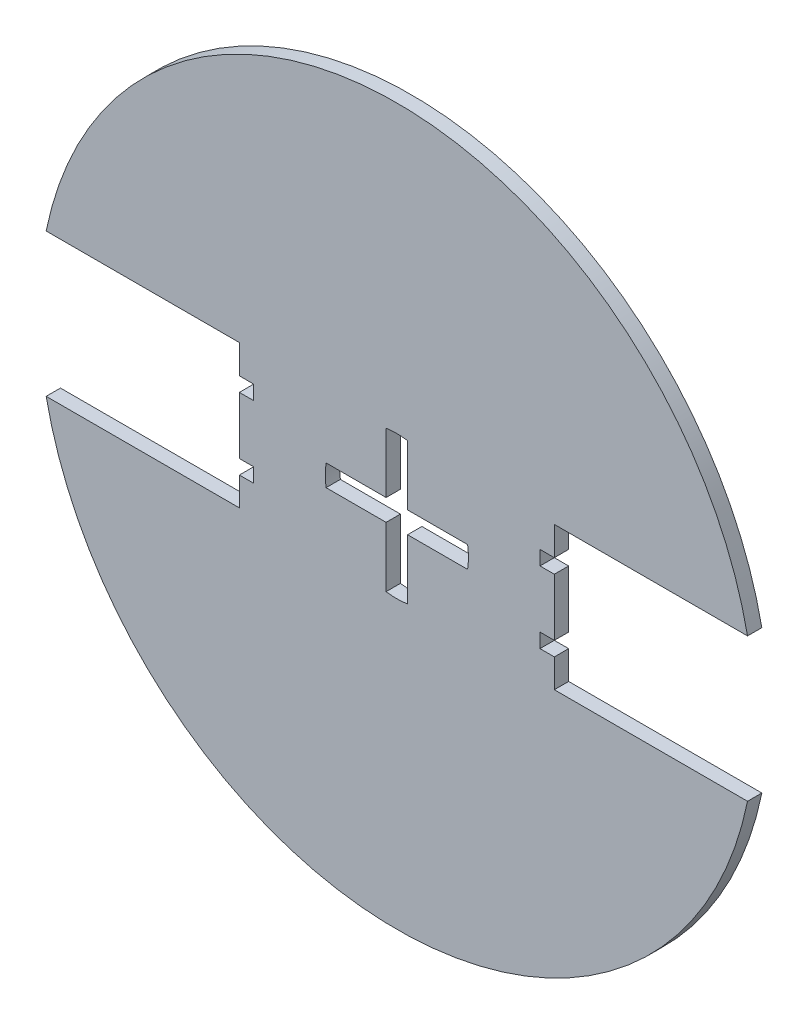
from build123d import *

# Parameters (mm, degrees)
BOSS_EXTRUDE5_DEPTH = 2
CUT_EXTRUDE17_DEPTH = 2
SKETCH11_3_W        = 3
SKETCH11_3_H        = 3
CUT_EXTRUDE18_DEPTH = 2
CUT_EXTRUDE19_DEPTH = 2
SKETCH14_W          = 2.001486185
SKETCH14_H          = 2
CUT_EXTRUDE20_DEPTH = 2
SKETCH13_W          = 2.001486185
SKETCH13_H          = 2
CUT_EXTRUDE21_DEPTH = 2


with BuildPart() as part:
    # Sketch1 → Boss-Extrude5 (new body)
    with BuildSketch(Plane.XY):
        with BuildLine():
            Line((-22, 10), (-22, -10))
            Line((-22, -10), (-48.989794856, -10))
            ThreePointArc((-48.989794856, -10), (50, 0), (-48.989794856, 10))
            Line((-48.989794856, 10), (-22, 10))
        make_face()
    extrude(amount=-BOSS_EXTRUDE5_DEPTH)

    # Sketch11 → Cut-Extrude17 (cut)
    with BuildSketch(Plane(origin=(0, 0, -2), x_dir=(-1, 0, 0), z_dir=(0, 0, -1))):
        with BuildLine():
            Line((-1.5, 1.5), (1.5, 1.5))
            Line((1.5, 1.5), (1.5, 9.886859967))
            ThreePointArc((1.5, 9.886859967), (0, 10), (-1.5, 9.886859967))
            Line((-1.5, 9.886859967), (-1.5, 1.5))
        make_face()
    extrude(amount=-CUT_EXTRUDE17_DEPTH, mode=Mode.SUBTRACT)

    # Sketch11<3> → Cut-Extrude18 (cut)
    with BuildSketch(Plane(origin=(0, 0, -2), x_dir=(-1, 0, 0), z_dir=(0, 0, -1))):
        with BuildLine():
            Line((-9.886859967, -1.5), (-1.5, -1.5))
            Line((-1.5, -1.5), (-1.5, 1.5))
            Line((-1.5, 1.5), (-9.886859967, 1.5))
            ThreePointArc((-9.886859967, 1.5), (-10, 0), (-9.886859967, -1.5))
        make_face()
        with BuildLine():
            Line((1.5, 1.5), (1.5, -1.5))
            Line((1.5, -1.5), (9.886859967, -1.5))
            ThreePointArc((9.886859967, -1.5), (9.971674876, -0.752130419), (10, 0))
            ThreePointArc((10, 0), (9.971674876, 0.752130419), (9.886859967, 1.5))
            Line((9.886859967, 1.5), (1.5, 1.5))
        make_face()
        with BuildLine():
            Line((1.5, -9.886859967), (1.5, -1.5))
            Line((1.5, -1.5), (-1.5, -1.5))
            Line((-1.5, -1.5), (-1.5, -9.886859967))
            ThreePointArc((-1.5, -9.886859967), (0, -10), (1.5, -9.886859967))
        make_face()
        Rectangle(SKETCH11_3_W, SKETCH11_3_H)
    extrude(amount=-CUT_EXTRUDE18_DEPTH, mode=Mode.SUBTRACT)

    # Sketch1<9> → Cut-Extrude19 (cut)
    with BuildSketch(Plane.XY):
        with BuildLine():
            Line((32.494897428, 10), (22, 10))
            Line((22, 10), (22, -10))
            Line((22, -10), (48.989794856, -10))
            ThreePointArc((48.989794856, -10), (49.74680765, -5.0254481), (50, 0))
            ThreePointArc((50, 0), (49.74680765, 5.0254481), (48.989794856, 10))
            Line((48.989794856, 10), (32.494897428, 10))
        make_face()
    extrude(amount=-CUT_EXTRUDE19_DEPTH, mode=Mode.SUBTRACT)

    # Sketch14 → Cut-Extrude20 (cut)
    with BuildSketch(Plane.ZY.offset(22)):
        with Locations((-0.999256907, -5.028117734)):
            Rectangle(SKETCH14_W, SKETCH14_H)
        with Locations((-0.999256907, 4.972809543)):
            Rectangle(SKETCH14_W, SKETCH14_H)
    extrude(amount=-CUT_EXTRUDE20_DEPTH, mode=Mode.SUBTRACT)

    # Sketch13 → Cut-Extrude21 (cut)
    with BuildSketch(Plane(origin=(22, 0, 0), x_dir=(0, 0, -1), z_dir=(1, 0, 0))):
        with Locations((0.999256907, -5.028117734)):
            Rectangle(SKETCH13_W, SKETCH13_H)
        with Locations((0.999256907, 4.972809543)):
            Rectangle(SKETCH13_W, SKETCH13_H)
    extrude(amount=-CUT_EXTRUDE21_DEPTH, mode=Mode.SUBTRACT)


solid = part.part
